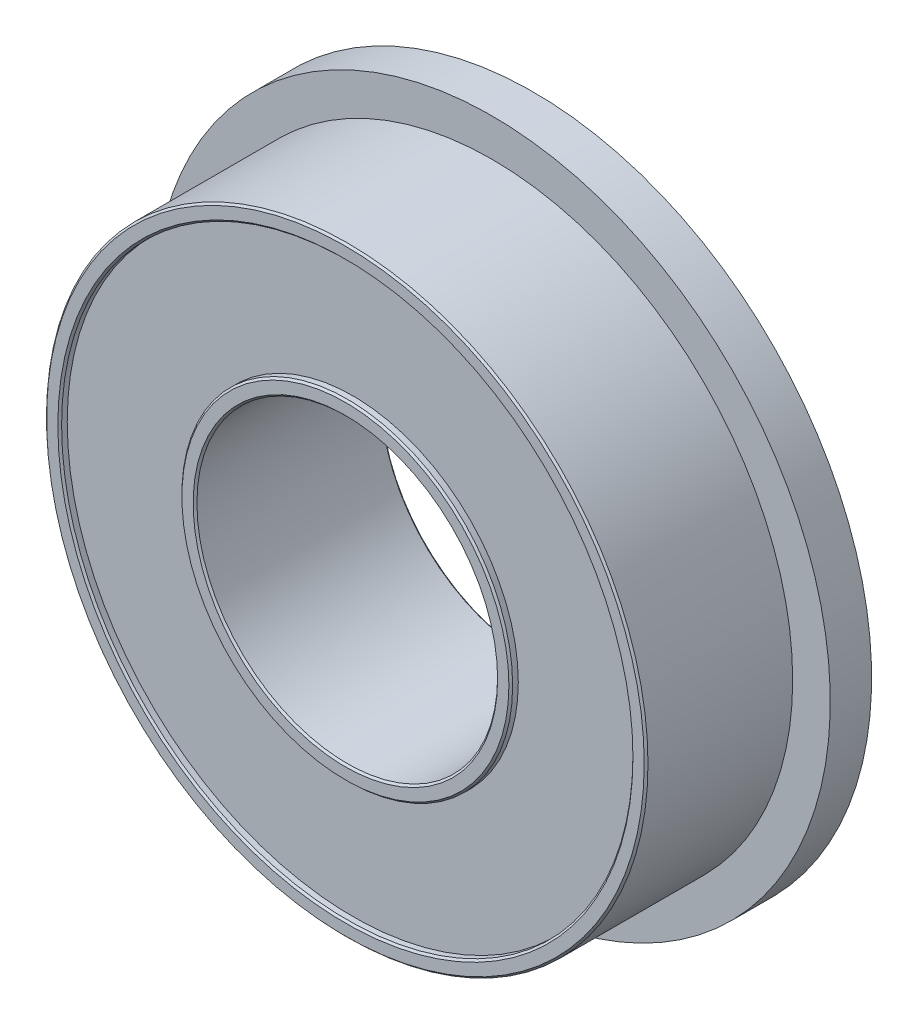
from build123d import *

# Parameters (mm, degrees)
SKETCH_1_R          = 8
SKETCH_1_R_2        = 4
EXTRUDE_1_DEPTH     = 2.5
SKETCH_3_R          = 9
SKETCH_3_R_2        = 4
EXTRUDE_2_DEPTH     = 1.1
SKETCH_4_R          = 7.6
SKETCH_4_R_2        = 4.4
CUT_EXTRUDE_1_DEPTH = 0.2
CHAMFER_1_SIZE      = 0.05


with BuildPart() as part:
    # 草图1 → 凸台-拉伸1 (new, symmetric)
    with BuildSketch(Plane.XY):
        Circle(SKETCH_1_R)
        Circle(SKETCH_1_R_2, mode=Mode.SUBTRACT)
    extrude(amount=EXTRUDE_1_DEPTH, both=True)

    # 草图3 → 凸台-拉伸2 (add)
    with BuildSketch(Plane(origin=(0, 0, -2.5), x_dir=(-1, 0, 0), z_dir=(0, 0, -1))):
        Circle(SKETCH_3_R)
        with Locations(Location((0, 0, 0), (0, 0, 180))):
            Circle(SKETCH_3_R_2, mode=Mode.SUBTRACT)
    extrude(amount=-EXTRUDE_2_DEPTH)

    # 草图4 → 切除-拉伸1 (cut)
    with BuildSketch(Plane.XY.offset(2.5)):
        Circle(SKETCH_4_R)
        Circle(SKETCH_4_R_2, mode=Mode.SUBTRACT)
    cut_extrude_1 = extrude(amount=-CUT_EXTRUDE_1_DEPTH, mode=Mode.SUBTRACT)

    # 镜向1: 切除-拉伸1 across plane
    add(cut_extrude_1.mirror(Plane.XY), mode=Mode.SUBTRACT)

    # 倒角1
    chamfer_1_edges = [part.edges().sort_by_distance(p)[0] for p in [
        (-7.6, 0, 2.5),
        (-4.4, 0, 2.5),
        (-4.4, 0, -2.5),
        (-7.6, 0, -2.5),
        (-8, 0, 2.5),
        (-4, 0, -2.5),
        (-4, 0, 2.5),
    ]]
    chamfer(chamfer_1_edges, length=CHAMFER_1_SIZE)


solid = part.part
